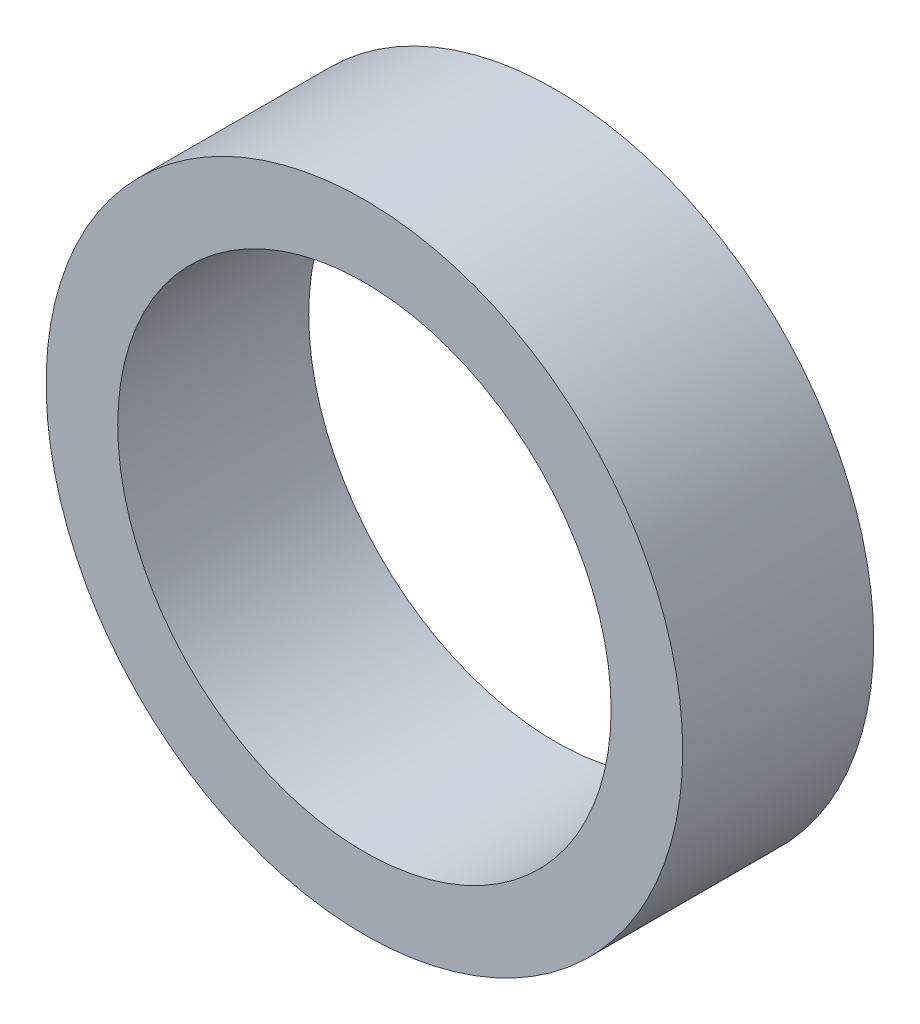
from build123d import *

# Parameters (mm, degrees)
SKETCH1_R           = 10
SKETCH1_R_2         = 7.75
BOSS_EXTRUDE1_DEPTH = 6


with BuildPart() as part:
    # Sketch1 → Boss-Extrude1 (new body)
    with BuildSketch(Plane.XY):
        Circle(SKETCH1_R)
        Circle(SKETCH1_R_2, mode=Mode.SUBTRACT)
    extrude(amount=BOSS_EXTRUDE1_DEPTH)


solid = part.part
